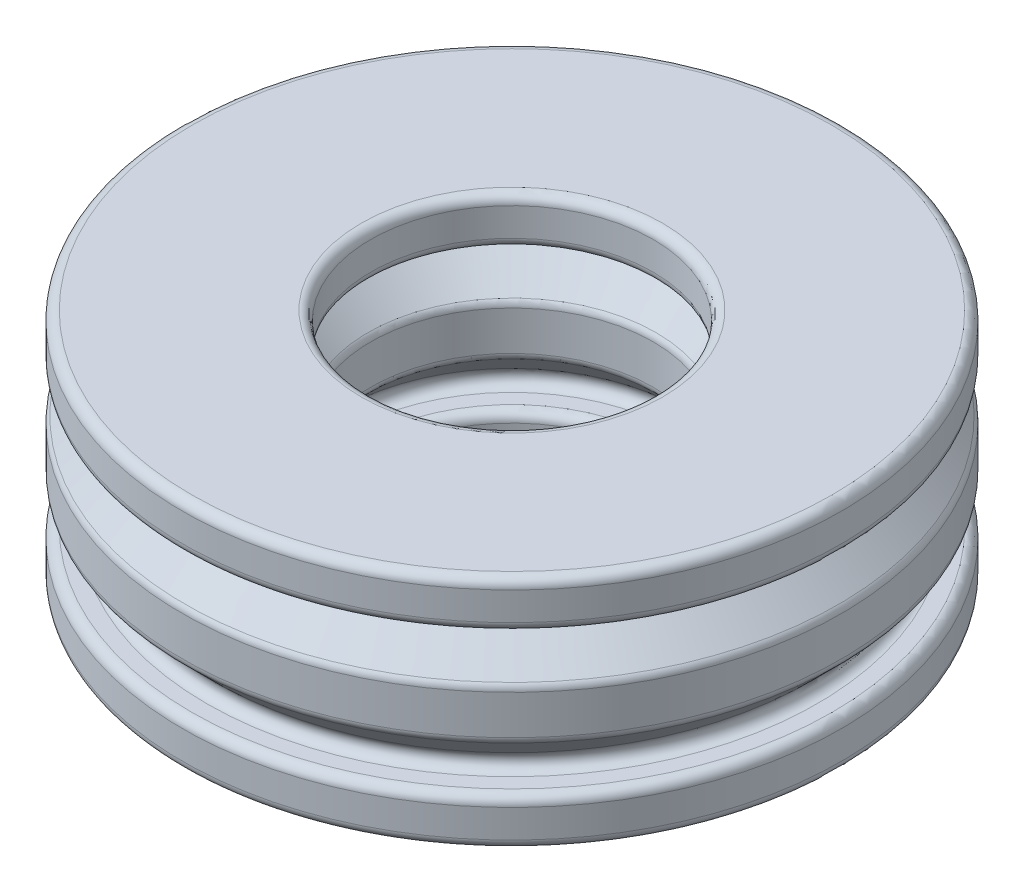
from build123d import *


with BuildPart() as part:
    # 草图1 → 旋转1 (revolve)
    with BuildSketch(Plane.XY, mode=Mode.PRIVATE) as revolve_1_sk:
        with BuildLine():
            Line((-3, 0.2), (-3, 0.8))
            ThreePointArc((-3, 0.8), (-3.058578644, 0.941421356), (-3.2, 1))
            Line((-3.2, 1), (-3.517157288, 1))
            ThreePointArc((-3.517157288, 1), (-3.701933194, 1.123463314), (-3.658578644, 1.341421356))
            Line((-3.658578644, 1.341421356), (-3.058578644, 1.941421356))
            ThreePointArc((-3.058578644, 1.941421356), (-3.015224093, 2.006306026), (-3, 2.082842712))
            Line((-3, 2.082842712), (-3, 2.917157288))
            ThreePointArc((-3, 2.917157288), (-3.015224093, 2.993693974), (-3.058578644, 3.058578644))
            Line((-3.058578644, 3.058578644), (-3.658578644, 3.658578644))
            ThreePointArc((-3.658578644, 3.658578644), (-3.701933194, 3.876536686), (-3.517157288, 4))
            Line((-3.517157288, 4), (-3.2, 4))
            ThreePointArc((-3.2, 4), (-3.058578644, 4.058578644), (-3, 4.2))
            Line((-3, 4.2), (-3, 4.8))
            ThreePointArc((-3, 4.8), (-3.058578644, 4.941421356), (-3.2, 5))
            Line((-3.2, 5), (-6.8, 5))
            ThreePointArc((-6.8, 5), (-6.941421356, 4.941421356), (-7, 4.8))
            Line((-7, 4.8), (-7, 4.2))
            ThreePointArc((-7, 4.2), (-6.941421356, 4.058578644), (-6.8, 4))
            Line((-6.8, 4), (-6.482842712, 4))
            ThreePointArc((-6.482842712, 4), (-6.298066806, 3.876536686), (-6.341421356, 3.658578644))
            Line((-6.341421356, 3.658578644), (-6.941421356, 3.058578644))
            ThreePointArc((-6.941421356, 3.058578644), (-6.984775907, 2.993693974), (-7, 2.917157288))
            Line((-7, 2.917157288), (-7, 2.082842712))
            ThreePointArc((-7, 2.082842712), (-6.984775907, 2.006306026), (-6.941421356, 1.941421356))
            Line((-6.941421356, 1.941421356), (-6.341421356, 1.341421356))
            ThreePointArc((-6.341421356, 1.341421356), (-6.298066806, 1.123463314), (-6.482842712, 1))
            Line((-6.482842712, 1), (-6.8, 1))
            ThreePointArc((-6.8, 1), (-6.941421356, 0.941421356), (-7, 0.8))
            Line((-7, 0.8), (-7, 0.2))
            ThreePointArc((-7, 0.2), (-6.941421356, 0.058578644), (-6.8, 0))
            Line((-6.8, 0), (-3.2, 0))
            ThreePointArc((-3.2, 0), (-3.058578644, 0.058578644), (-3, 0.2))
        make_face()
    revolve(revolve_1_sk.sketch.rotate(Axis((0, 0, 0), (0, 1, 0)), 270), axis=Axis((0, 0, 0), (0, 1, 0)))


solid = part.part
